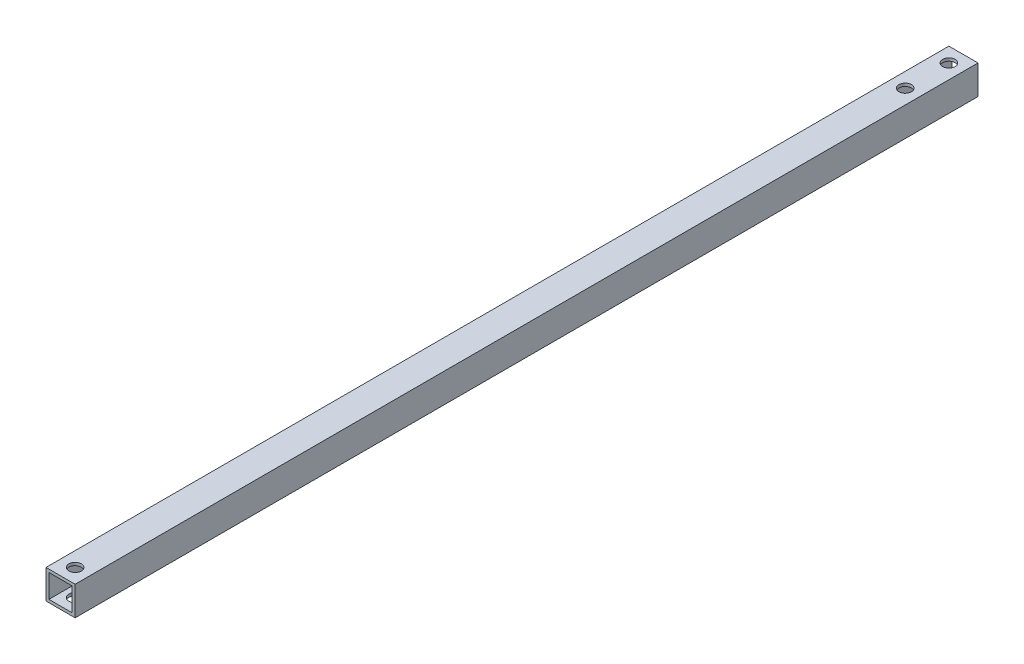
from build123d import *

# Parameters (mm, degrees)
SKETCH_2_W          = 10
SKETCH_2_H          = 10
SKETCH_2_W_2        = 8
SKETCH_2_H_2        = 8
EXTRUDE_1_DEPTH     = 310
CUT_EXTRUDE_1_REACH = 312.322
SKETCH_3_R          = 2.15


with BuildPart() as part:
    # ｽｹｯﾁ2 → 押し出し-薄板1 (new body)
    with BuildSketch(Plane.XY):
        with Locations((5, 5)):
            Rectangle(SKETCH_2_W, SKETCH_2_H)
        with Locations((5, 5)):
            Rectangle(SKETCH_2_W_2, SKETCH_2_H_2, mode=Mode.SUBTRACT)
    extrude(amount=EXTRUDE_1_DEPTH)

    # ｶｯﾄ - 押し出し1: up to this face of the body (flat: up to its plane)
    cut_extrude_1_end = Plane(part.part.faces().sort_by_distance((5, 0, 155))[0])
    # ｽｹｯﾁ3 → ｶｯﾄ - 押し出し1 (cut, up to the picked face)
    with BuildSketch(Plane(origin=(0, 10, 0), x_dir=(1, 0, 0), z_dir=(0, 1, 0)), mode=Mode.PRIVATE) as cut_extrude_1_sk1:
        with Locations(Location((5, -305, 0), (0, 0, 270))):
            Circle(SKETCH_3_R)
    cut_extrude_1_tool1 = split(extrude(cut_extrude_1_sk1.sketch, amount=-CUT_EXTRUDE_1_REACH, mode=Mode.PRIVATE), bisect_by=cut_extrude_1_end, keep=Keep.BOTH, mode=Mode.PRIVATE)
    # ｽｹｯﾁ3 → ｶｯﾄ - 押し出し1 (cut, up to the picked face)
    with BuildSketch(Plane(origin=(0, 10, 0), x_dir=(1, 0, 0), z_dir=(0, 1, 0)), mode=Mode.PRIVATE) as cut_extrude_1_sk2:
        with Locations(Location((5, -5, 0), (0, 0, 90))):
            Circle(SKETCH_3_R)
    cut_extrude_1_tool2 = split(extrude(cut_extrude_1_sk2.sketch, amount=-CUT_EXTRUDE_1_REACH, mode=Mode.PRIVATE), bisect_by=cut_extrude_1_end, keep=Keep.BOTH, mode=Mode.PRIVATE)
    # ｽｹｯﾁ3 → ｶｯﾄ - 押し出し1 (cut, up to the picked face)
    with BuildSketch(Plane(origin=(0, 10, 0), x_dir=(1, 0, 0), z_dir=(0, 1, 0)), mode=Mode.PRIVATE) as cut_extrude_1_sk3:
        with Locations(Location((5, -20, 0), (0, 0, 270))):
            Circle(SKETCH_3_R)
    cut_extrude_1_tool3 = split(extrude(cut_extrude_1_sk3.sketch, amount=-CUT_EXTRUDE_1_REACH, mode=Mode.PRIVATE), bisect_by=cut_extrude_1_end, keep=Keep.BOTH, mode=Mode.PRIVATE)
    add(cut_extrude_1_tool1.solids().sort_by(Axis((5, 10, 305), (0, -1, 0)))[0], mode=Mode.SUBTRACT)
    add(cut_extrude_1_tool2.solids().sort_by(Axis((5, 10, 5), (0, -1, 0)))[0], mode=Mode.SUBTRACT)
    add(cut_extrude_1_tool3.solids().sort_by(Axis((5, 10, 20), (0, -1, 0)))[0], mode=Mode.SUBTRACT)


solid = part.part
